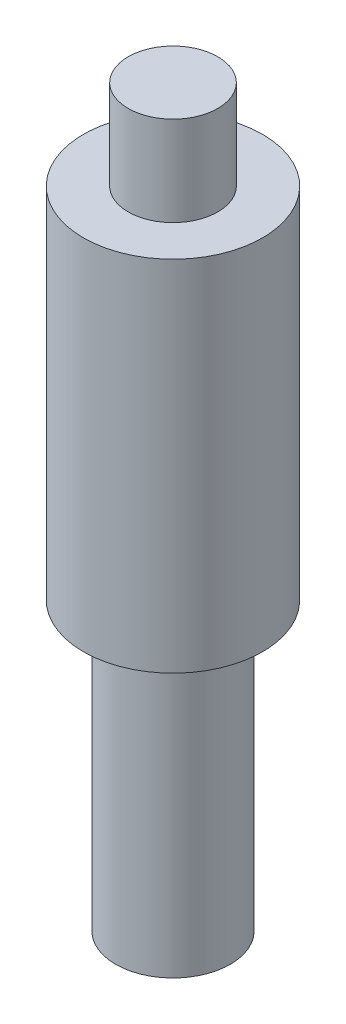
from build123d import *

# Parameters (mm, degrees)
SKETCH_1_R      = 1.6
EXTRUDE_1_DEPTH = 8
SKETCH_2_R      = 2.5
EXTRUDE_2_DEPTH = 10
SKETCH_3_R      = 1.25
EXTRUDE_3_DEPTH = 2.5


with BuildPart() as part:
    # 草图1 → 凸台-拉伸1 (new body)
    with BuildSketch(Plane(origin=(0, 0, 0), x_dir=(1, 0, 0), z_dir=(0, 1, 0))):
        with Locations(Location((0, 0, 0), (0, 0, 270))):
            Circle(SKETCH_1_R)
    extrude(amount=EXTRUDE_1_DEPTH)

    # 草图2 → 凸台-拉伸2 (add)
    with BuildSketch(Plane(origin=(0, 8, 0), x_dir=(1, 0, 0), z_dir=(0, 1, 0))):
        with Locations(Location((0, 0, 0), (0, 0, 270))):
            Circle(SKETCH_2_R)
    extrude(amount=EXTRUDE_2_DEPTH)

    # 草图3 → 凸台-拉伸3 (add)
    with BuildSketch(Plane(origin=(0, 18, 0), x_dir=(1, 0, 0), z_dir=(0, 1, 0))):
        with Locations(Location((0, 0, 0), (0, 0, 270))):
            Circle(SKETCH_3_R)
    extrude(amount=EXTRUDE_3_DEPTH)


solid = part.part
